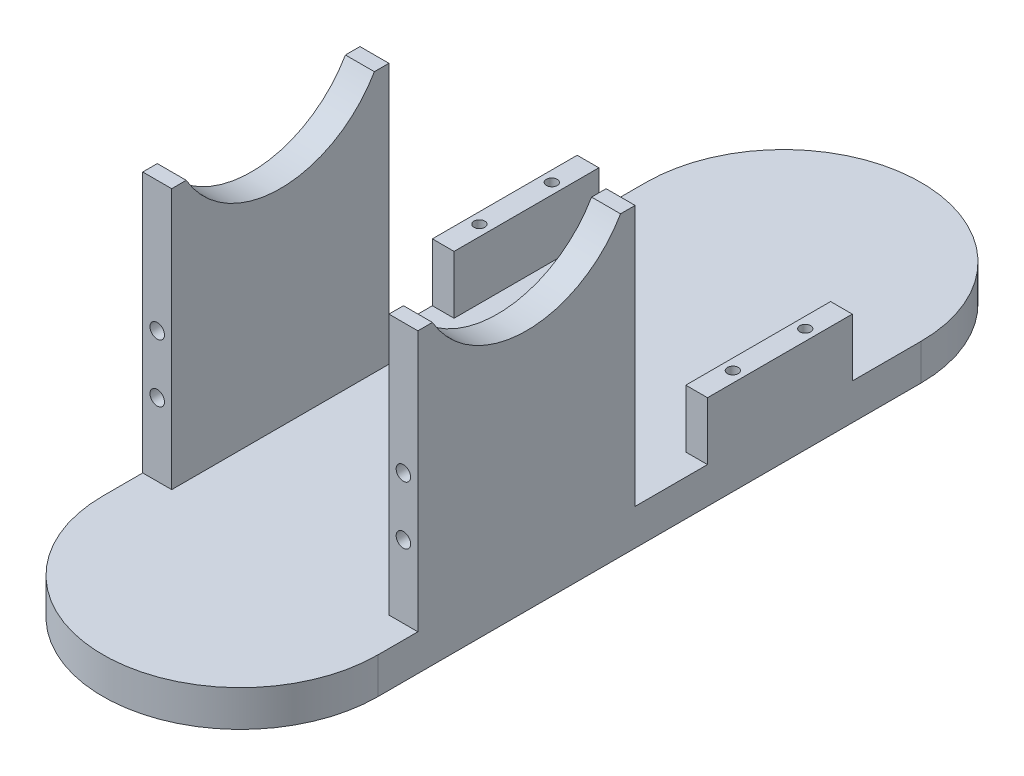
from build123d import *

# Parameters (mm, degrees)
EXTRUDE_1_DEPTH     = 10
SKETCH_3_W          = 8
SKETCH_3_H          = 60
EXTRUDE_2_DEPTH     = 72
SKETCH_4_W          = 6
SKETCH_4_H          = 40
EXTRUDE_3_DEPTH     = 16
SKETCH_5_R          = 30
CUT_EXTRUDE_1_DEPTH = 159.962259672
SKETCH_6_R          = 2
CUT_EXTRUDE_2_DEPTH = 10
SKETCH_7_R          = 1.5
CUT_EXTRUDE_3_DEPTH = 10


with BuildPart() as part:
    # 草图1 → 凸台-拉伸1 (new body)
    with BuildSketch(Plane(origin=(0, 0, 0), x_dir=(1, 0, 0), z_dir=(0, 1, 0))):
        with BuildLine():
            Line((-38, -75), (-38, 75))
            ThreePointArc((-38, 75), (0, 113), (38, 75))
            Line((38, 75), (38, -75))
            ThreePointArc((38, -75), (0, -113), (-38, -75))
        make_face()
    extrude(amount=EXTRUDE_1_DEPTH)

    # 草图3 → 凸台-拉伸2 (add)
    with BuildSketch(Plane(origin=(0, 10, 0), x_dir=(1, 0, 0), z_dir=(0, 1, 0))):
        with Locations((-34, -34)):
            Rectangle(SKETCH_3_W, SKETCH_3_H)
        with Locations((34, -34)):
            Rectangle(SKETCH_3_W, SKETCH_3_H)
    extrude(amount=EXTRUDE_2_DEPTH)

    # 草图4 → 凸台-拉伸3 (add)
    with BuildSketch(Plane(origin=(0, 10, 0), x_dir=(1, 0, 0), z_dir=(0, 1, 0))):
        with Locations((-35, 36)):
            Rectangle(SKETCH_4_W, SKETCH_4_H)
        with Locations((35, 36)):
            Rectangle(SKETCH_4_W, SKETCH_4_H)
    extrude(amount=EXTRUDE_3_DEPTH)

    # 草图5 → 切除-拉伸1 (cut, through all)
    with BuildSketch(Plane(origin=(38, 0, 0), x_dir=(0, 0, -1), z_dir=(1, 0, 0))):
        with Locations((-34, 97)):
            Circle(SKETCH_5_R)
    extrude(amount=-CUT_EXTRUDE_1_DEPTH, mode=Mode.SUBTRACT)

    # 草图6 → 切除-拉伸2 (cut)
    with BuildSketch(Plane.XY.offset(64)):
        with Locations((-34, 46)):
            Circle(SKETCH_6_R)
        with Locations((-34, 30)):
            Circle(SKETCH_6_R)
        with Locations((34, 46)):
            Circle(SKETCH_6_R)
        with Locations((34, 30)):
            Circle(SKETCH_6_R)
    extrude(amount=-CUT_EXTRUDE_2_DEPTH, mode=Mode.SUBTRACT)

    # 草图7 → 切除-拉伸3 (cut)
    with BuildSketch(Plane(origin=(0, 26, 0), x_dir=(1, 0, 0), z_dir=(0, 1, 0))):
        with Locations(Location((-35, 26, 0), (0, 0, 270))):
            Circle(SKETCH_7_R)
        with Locations(Location((-35, 46, 0), (0, 0, 270))):
            Circle(SKETCH_7_R)
        with Locations(Location((35, 26, 0), (0, 0, 270))):
            Circle(SKETCH_7_R)
        with Locations(Location((35, 46, 0), (0, 0, 270))):
            Circle(SKETCH_7_R)
    extrude(amount=-CUT_EXTRUDE_3_DEPTH, mode=Mode.SUBTRACT)


solid = part.part
